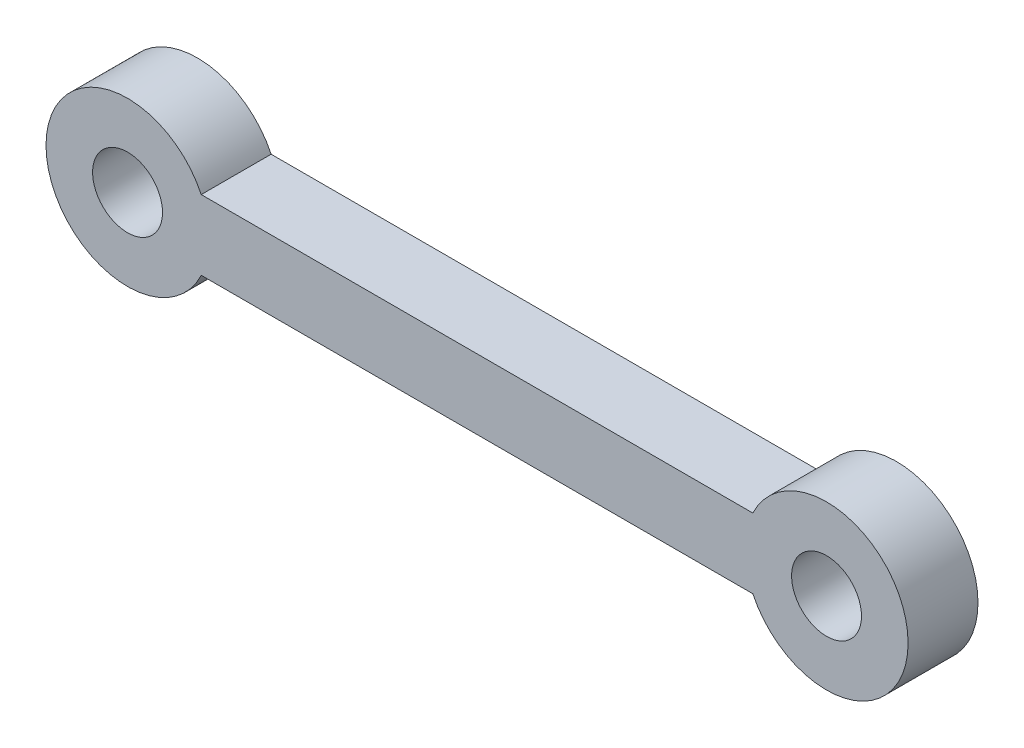
from build123d import *

# Parameters (mm, degrees)
SKETCH_1_R      = 1.5
EXTRUDE_1_DEPTH = 3


with BuildPart() as part:
    # 草图1 → 凸台-拉伸1 (new body)
    with BuildSketch(Plane.XY):
        with BuildLine():
            Line((3.16227766, 1.5), (26.83772234, 1.5))
            ThreePointArc((26.83772234, 1.5), (33.5, 0), (26.83772234, -1.5))
            Line((26.83772234, -1.5), (3.16227766, -1.5))
            ThreePointArc((3.16227766, -1.5), (-3.5, 0), (3.16227766, 1.5))
        make_face()
        Circle(SKETCH_1_R, mode=Mode.SUBTRACT)
        with Locations((30, 0)):
            Circle(SKETCH_1_R, mode=Mode.SUBTRACT)
    extrude(amount=EXTRUDE_1_DEPTH)


solid = part.part
